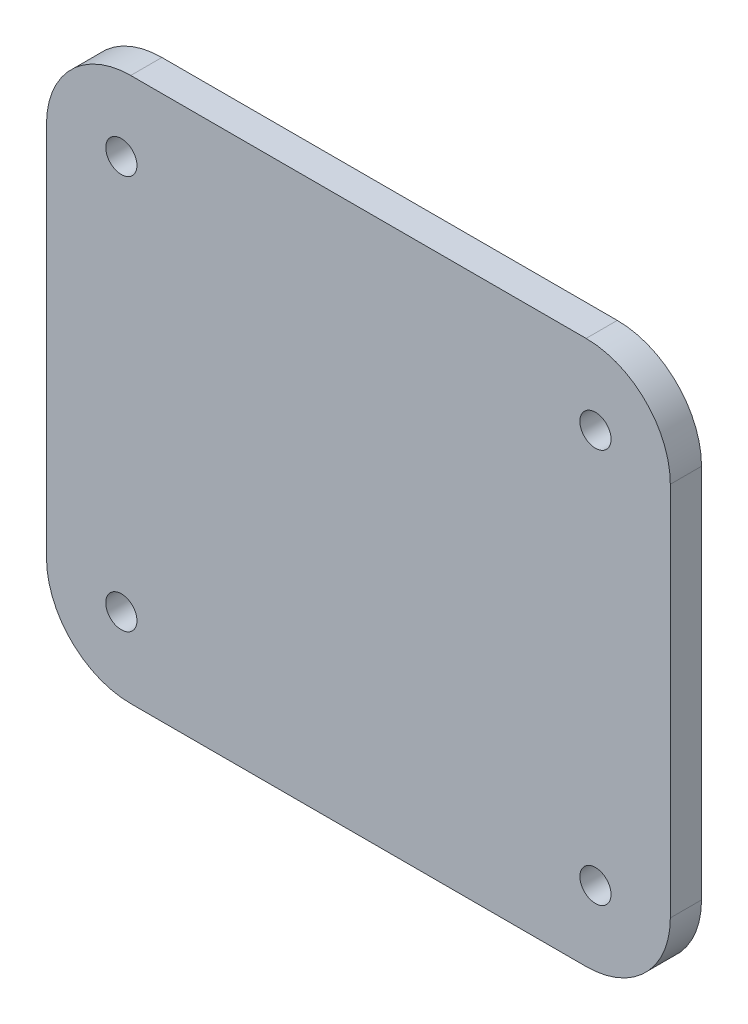
from build123d import *

# Parameters (mm, degrees)
Y_KSEKLIK_EKSTR_ZYON1_DEPTH = 5
IZIM2_R                     = 2.5
KES_EKSTR_ZYON1_DEPTH       = 10
RADYUS1_R                   = 13.5


with BuildPart() as part:
    # Çizim1 → Yükseklik-Ekstrüzyon1 (new body)
    with BuildSketch(Plane.XY):
        Polygon((21, 43.6), (50, 43.6), (50, -43.6), (-50, -43.6), (-50, 43.6), (-21, 43.6), align=None)
    extrude(amount=Y_KSEKLIK_EKSTR_ZYON1_DEPTH)

    # Çizim2 → Kes-Ekstrüzyon1 (cut)
    with BuildSketch(Plane.XY.offset(5)):
        with Locations((38, -31.6)):
            Circle(IZIM2_R)
        with Locations((38, 31.6)):
            Circle(IZIM2_R)
        with Locations((-38, 31.6)):
            Circle(IZIM2_R)
        with Locations((-38, -31.6)):
            Circle(IZIM2_R)
    extrude(amount=-KES_EKSTR_ZYON1_DEPTH, mode=Mode.SUBTRACT)

    # Radyus1
    radyus1_edges = [part.edges().sort_by_distance(p)[0] for p in [
        (50, -43.6, 2.5),
        (-50, -43.6, 2.5),
        (-50, 43.6, 2.5),
        (50, 43.6, 2.5),
    ]]
    fillet(radyus1_edges, radius=RADYUS1_R)


solid = part.part
